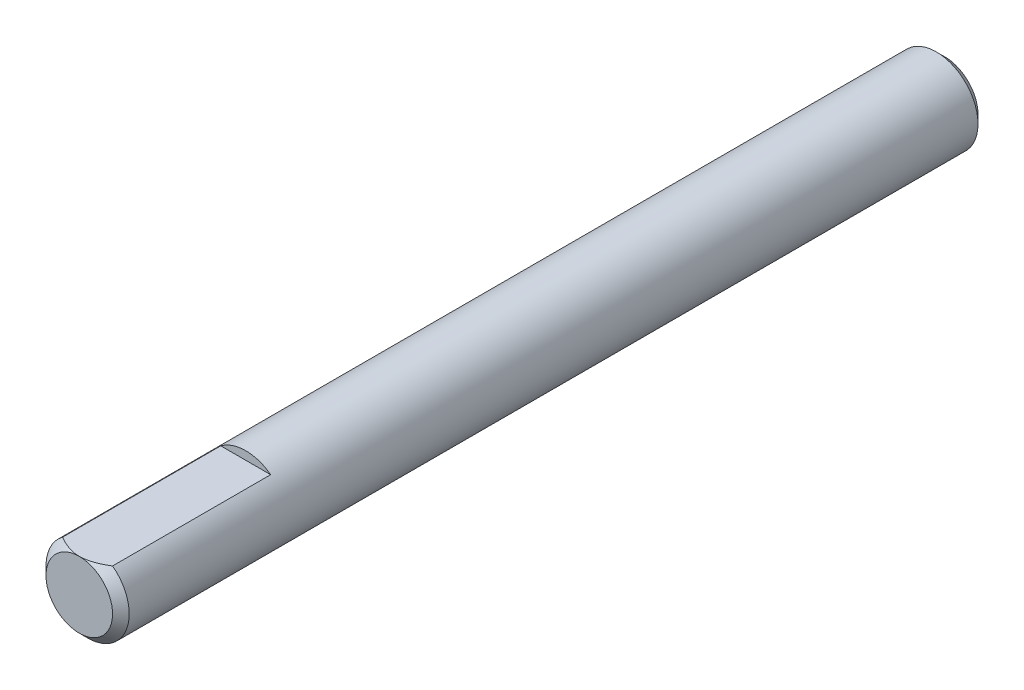
from build123d import *

# Parameters (mm, degrees)
SKETCH1_R           = 2.5
BOSS_EXTRUDE1_DEPTH = 52
CHAMFER1_SIZE       = 0.5
CUT_EXTRUDE1_DEPTH  = 10


with BuildPart() as part:
    # Sketch1 → Boss-Extrude1 (new body)
    with BuildSketch(Plane.XY):
        Circle(SKETCH1_R)
    extrude(amount=-BOSS_EXTRUDE1_DEPTH)

    # Chamfer1
    chamfer1_edges = [part.edges().sort_by_distance(p)[0] for p in [
        (-2.5, 0, 0),
        (-2.5, 0, -52),
    ]]
    chamfer(chamfer1_edges, length=CHAMFER1_SIZE)

    # Sketch2 → Cut-Extrude1 (cut)
    with BuildSketch(Plane.XY):
        with BuildLine():
            Line((-1.5, 2), (1.5, 2))
            ThreePointArc((1.5, 2), (0, 2.5), (-1.5, 2))
        make_face()
    extrude(amount=-CUT_EXTRUDE1_DEPTH, mode=Mode.SUBTRACT)


solid = part.part
